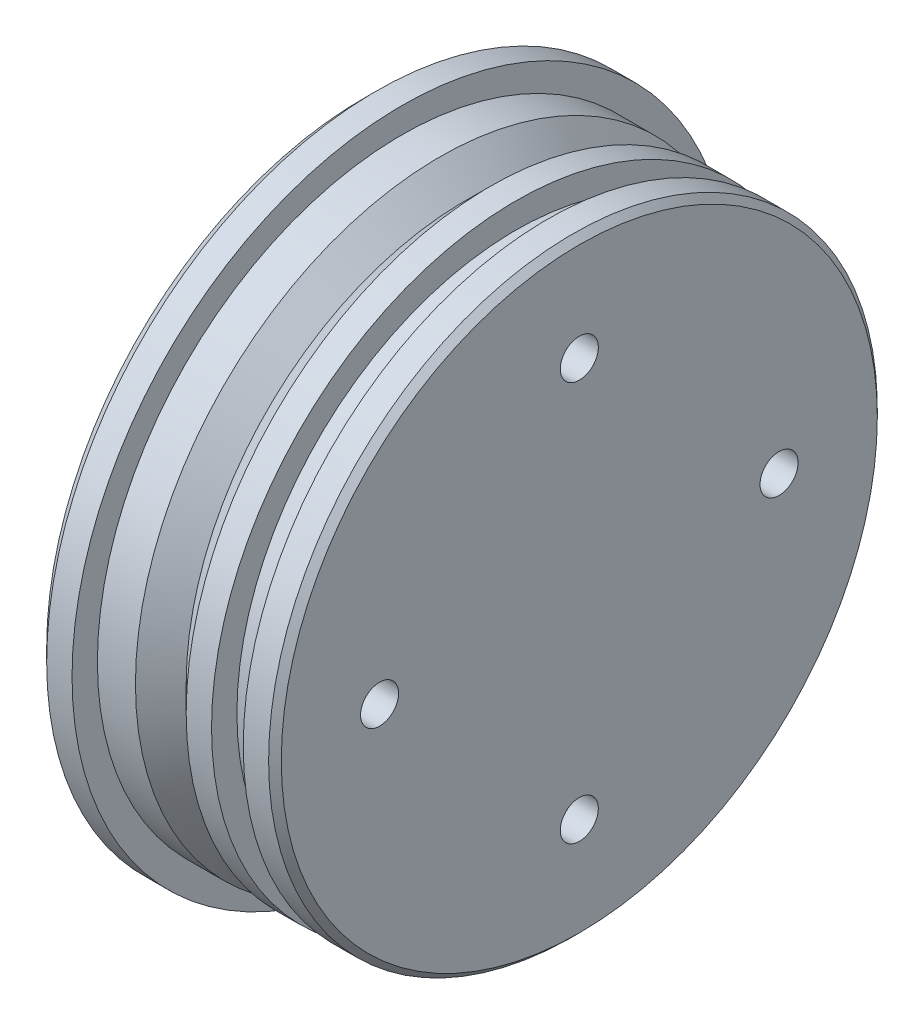
from build123d import *

# Parameters (mm, degrees)
SKETCH_2_R          = 1.5
CUT_EXTRUDE_1_DEPTH = 10


with BuildPart() as part:
    # Эскиз1 → Повернуть1 (revolve)
    with BuildSketch(Plane.XY, mode=Mode.PRIVATE) as revolve_1_sk:
        Polygon((-17, 0), (-17, 25), (-16, 26), (-14, 26), (-14, 24), (-11, 24), (-9, 22), (-7, 24), (-5, 24), (-5, 22), (-2.5, 22), (-2.5, 24), (-0.5, 24), (0, 23.5), (0, 0), align=None)
    revolve(revolve_1_sk.sketch.rotate(Axis((0, 0, 0), (1, 0, 0)), 90), axis=Axis((0, 0, 0), (1, 0, 0)))

    # Эскиз2 → Вырез-Вытянуть1 (cut)
    with BuildSketch(Plane(origin=(0, 0, 0), x_dir=(0, 0, -1), z_dir=(1, 0, 0))):
        with Locations((0, 15.75)):
            Circle(SKETCH_2_R)
        with Locations((15.75, 0)):
            Circle(SKETCH_2_R)
        with Locations((-15.75, 0)):
            Circle(SKETCH_2_R)
        with Locations((0, -15.75)):
            Circle(SKETCH_2_R)
    extrude(amount=-CUT_EXTRUDE_1_DEPTH, mode=Mode.SUBTRACT)


solid = part.part
